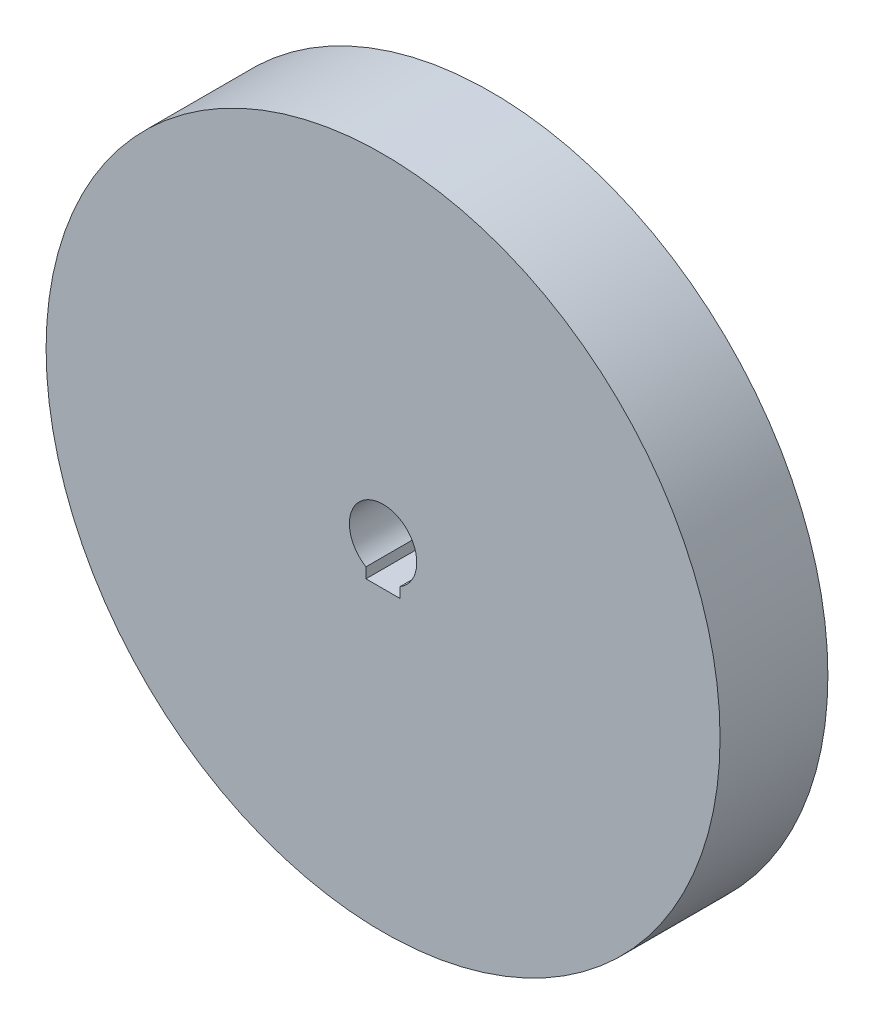
from build123d import *

# Parameters (mm, degrees)
SKETCH1_R           = 125
SKETCH1_R_2         = 12.5
BOSS_EXTRUDE1_DEPTH = 40
CUT_EXTRUDE1_REACH  = 183.246
SKETCH2_W           = 12.682043214
SKETCH2_H           = 5.67447182


with BuildPart() as part:
    # Sketch1 → Boss-Extrude1 (new body)
    with BuildSketch(Plane.XY):
        Circle(SKETCH1_R)
        Circle(SKETCH1_R_2, mode=Mode.SUBTRACT)
    extrude(amount=BOSS_EXTRUDE1_DEPTH)

    # Sketch2 → Cut-Extrude1 (cut, up to next)
    with BuildSketch(Plane.XY.offset(40), mode=Mode.PRIVATE) as cut_extrude1_sk1:
        with Locations((0, -11.797375137)):
            Rectangle(SKETCH2_W, SKETCH2_H)
    cut_extrude1_tool1 = extrude(cut_extrude1_sk1.sketch, amount=-CUT_EXTRUDE1_REACH, mode=Mode.PRIVATE) & part.part
    add(cut_extrude1_tool1.solids().sort_by_distance((0, -11.797375, 40))[0], mode=Mode.SUBTRACT)


solid = part.part
